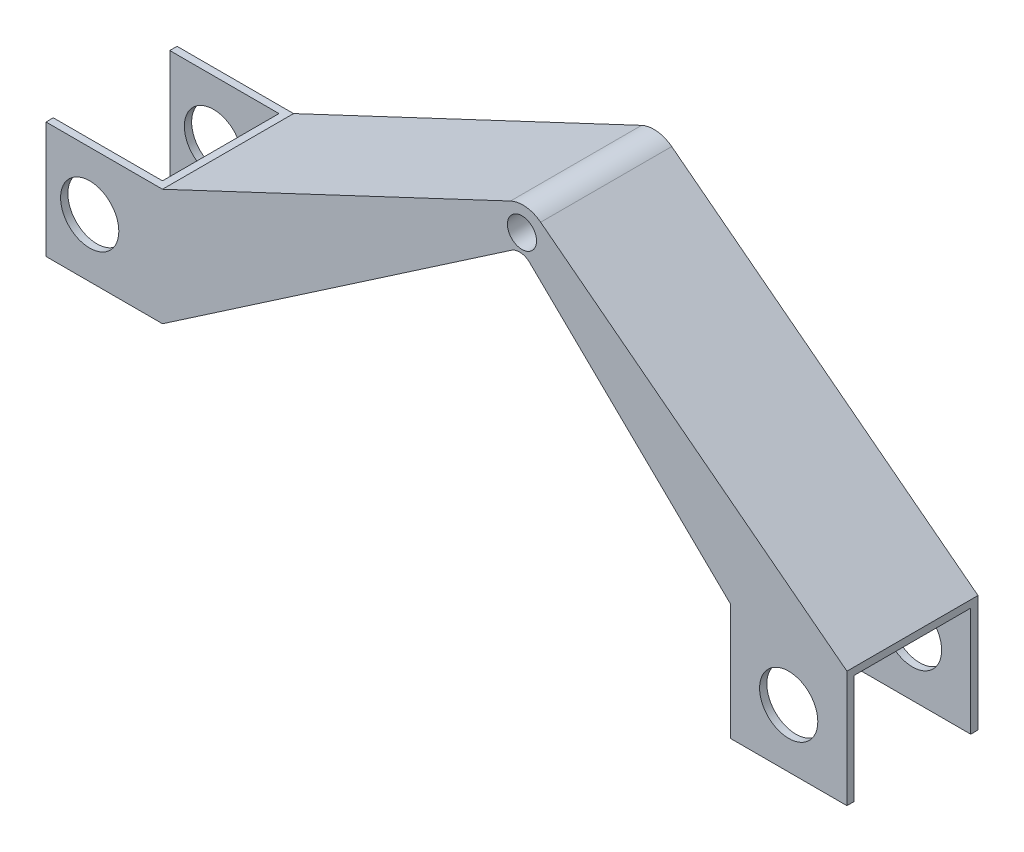
from build123d import *

# Parameters (mm, degrees)
SKETCH1_W           = 203.2
SKETCH1_H           = 203.2
BOSS_EXTRUDE1_DEPTH = 228.6
CUT_EXTRUDE1_DEPTH  = 228.6
SKETCH3_R           = 50.8
CUT_EXTRUDE2_DEPTH  = 271.005703643
BOSS_EXTRUDE2_DEPTH = 228.6
CUT_EXTRUDE3_DEPTH  = 1278.174091308
SKETCH7_R           = 50.8
CUT_EXTRUDE4_DEPTH  = 1373.616617817
SKETCH8_R           = 25.4
CUT_EXTRUDE5_DEPTH  = 1373.616617817


with BuildPart() as part:
    # Sketch1 → Boss-Extrude1 (new body)
    with BuildSketch(Plane.XY):
        Rectangle(SKETCH1_W, SKETCH1_H)
    extrude(amount=BOSS_EXTRUDE1_DEPTH)

    # Sketch2 → Cut-Extrude1 (cut)
    with BuildSketch(Plane(origin=(0, 101.6, 0), x_dir=(1, 0, 0), z_dir=(0, 1, 0))):
        Polygon((-88.9, -12.7), (-131.920098672, -12.7), (-131.920098672, -215.9), (-88.9, -215.9), (88.9, -215.9), (88.9, -12.7), align=None)
    extrude(amount=-CUT_EXTRUDE1_DEPTH, mode=Mode.SUBTRACT)

    # Sketch3 → Cut-Extrude2 (cut, through all)
    with BuildSketch(Plane.XY.offset(228.6)):
        with Locations((-25.4, 0)):
            Circle(SKETCH3_R)
    extrude(amount=-CUT_EXTRUDE2_DEPTH, mode=Mode.SUBTRACT)

    # Sketch5 → Boss-Extrude2 (add)
    with BuildSketch(Plane.XY):
        with BuildLine():
            Line((101.6, 101.6), (708.554663443, 387.282081105))
            ThreePointArc((708.554663443, 387.282081105), (735.661628292, 391.823256752), (761.166531666, 381.580711976))
            Line((761.166531666, 381.580711976), (1295.4, -29.464807141))
            Line((1295.4, -29.464807141), (1295.4, -232.664807141))
            Line((1295.4, -232.664807141), (1092.2, -232.664807141))
            Line((1092.2, -232.664807141), (1092.2, -29.464807141))
            Line((1092.2, -29.464807141), (742.133450583, 310.915917798))
            ThreePointArc((742.133450583, 310.915917798), (726.614813955, 318.010811429), (710.108636303, 313.685109437))
            Line((710.108636303, 313.685109437), (101.6, -101.6))
            Line((101.6, -101.6), (101.6, 101.6))
        make_face()
    extrude(amount=BOSS_EXTRUDE2_DEPTH)

    # Sketch6 → Cut-Extrude3 (cut, through all)
    with BuildSketch(Plane.ZY.offset(-1092.2)):
        Polygon((12.7, -219.964807141), (12.7, -266.729426715), (215.9, -266.729426715), (215.9, -219.964807141), (215.9, -42.164807141), (12.7, -42.164807141), align=None)
    extrude(amount=-CUT_EXTRUDE3_DEPTH, mode=Mode.SUBTRACT)

    # Sketch7 → Cut-Extrude4 (cut, through all)
    with BuildSketch(Plane.XY.offset(228.6)):
        with Locations((1193.8, -131.064807141)):
            Circle(SKETCH7_R)
    extrude(amount=-CUT_EXTRUDE4_DEPTH, mode=Mode.SUBTRACT)

    # Sketch8 → Cut-Extrude5 (cut, through all)
    with BuildSketch(Plane.XY.offset(228.6)):
        with Locations((728.615646145, 349.569241459)):
            Circle(SKETCH8_R)
    extrude(amount=-CUT_EXTRUDE5_DEPTH, mode=Mode.SUBTRACT)


solid = part.part
